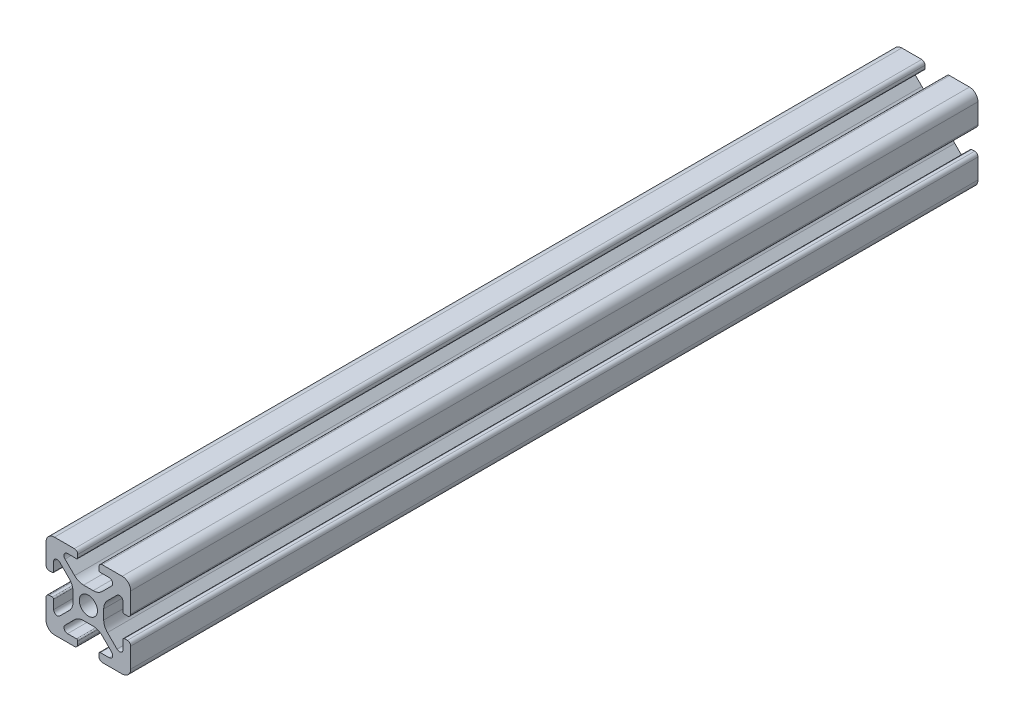
from build123d import *

# Parameters (mm, degrees)
SKETCH1_R                     = 2.1463
BOSS_EXTRUDE1_DEPTH           = 100
M6_CLEARANCE_HOLE1_AT_2_COUNT = 2
M6_CLEARANCE_HOLE1_AT_2_PITCH = 170


with BuildPart() as part:
    # Sketch1 → Boss-Extrude1 (new, symmetric)
    with BuildSketch(Plane.XY):
        with BuildLine():
            Line((-9.9949, 7.9883), (-9.9949, 3.2893))
            ThreePointArc((-9.9949, 3.2893), (-9.76427588, 2.73252412), (-9.2075, 2.5019))
            Line((-9.2075, 2.5019), (-8.4963, 2.5019))
            ThreePointArc((-8.4963, 2.5019), (-8.280773853, 2.591173853), (-8.1915, 2.8067))
            Line((-8.1915, 2.8067), (-8.1915, 4.9149))
            ThreePointArc((-8.1915, 4.9149), (-7.674065253, 5.689295824), (-6.760603096, 5.507596904))
            Line((-6.760603096, 5.507596904), (-4.505765747, 3.252759555))
            ThreePointArc((-4.505765747, 3.252759555), (-3.856054457, 2.280397894), (-3.627906192, 1.133419111))
            Line((-3.627906192, 1.133419111), (-3.627906192, -1.133419111))
            ThreePointArc((-3.627906192, -1.133419111), (-3.856054457, -2.280397894), (-4.505765747, -3.252759555))
            Line((-4.505765747, -3.252759555), (-6.760603096, -5.507596904))
            ThreePointArc((-6.760603096, -5.507596904), (-7.674065253, -5.689295824), (-8.1915, -4.9149))
            Line((-8.1915, -4.9149), (-8.1915, -2.8067))
            ThreePointArc((-8.1915, -2.8067), (-8.280773853, -2.591173853), (-8.4963, -2.5019))
            Line((-8.4963, -2.5019), (-9.2075, -2.5019))
            ThreePointArc((-9.2075, -2.5019), (-9.76427588, -2.73252412), (-9.9949, -3.2893))
            Line((-9.9949, -3.2893), (-9.9949, -7.9883))
            ThreePointArc((-9.9949, -7.9883), (-9.407180467, -9.407180467), (-7.9883, -9.9949))
            Line((-7.9883, -9.9949), (-3.2893, -9.9949))
            ThreePointArc((-3.2893, -9.9949), (-2.73252412, -9.76427588), (-2.5019, -9.2075))
            Line((-2.5019, -9.2075), (-2.5019, -8.4963))
            ThreePointArc((-2.5019, -8.4963), (-2.591173853, -8.280773853), (-2.8067, -8.1915))
            Line((-2.8067, -8.1915), (-4.9149, -8.1915))
            ThreePointArc((-4.9149, -8.1915), (-5.689295824, -7.674065253), (-5.507596904, -6.760603096))
            Line((-5.507596904, -6.760603096), (-3.252759555, -4.505765747))
            ThreePointArc((-3.252759555, -4.505765747), (-2.280397894, -3.856054457), (-1.133419111, -3.627906192))
            Line((-1.133419111, -3.627906192), (1.133419111, -3.627906192))
            ThreePointArc((1.133419111, -3.627906192), (2.280397894, -3.856054457), (3.252759555, -4.505765747))
            Line((3.252759555, -4.505765747), (5.507596904, -6.760603096))
            ThreePointArc((5.507596904, -6.760603096), (5.689295824, -7.674065253), (4.9149, -8.1915))
            Line((4.9149, -8.1915), (2.8067, -8.1915))
            ThreePointArc((2.8067, -8.1915), (2.591173853, -8.280773853), (2.5019, -8.4963))
            Line((2.5019, -8.4963), (2.5019, -9.2075))
            ThreePointArc((2.5019, -9.2075), (2.73252412, -9.76427588), (3.2893, -9.9949))
            Line((3.2893, -9.9949), (7.9883, -9.9949))
            ThreePointArc((7.9883, -9.9949), (9.407180467, -9.407180467), (9.9949, -7.9883))
            Line((9.9949, -7.9883), (9.9949, -3.2893))
            ThreePointArc((9.9949, -3.2893), (9.76427588, -2.73252412), (9.2075, -2.5019))
            Line((9.2075, -2.5019), (8.4963, -2.5019))
            ThreePointArc((8.4963, -2.5019), (8.280773853, -2.591173853), (8.1915, -2.8067))
            Line((8.1915, -2.8067), (8.1915, -4.9149))
            ThreePointArc((8.1915, -4.9149), (7.674065253, -5.689295824), (6.760603096, -5.507596904))
            Line((6.760603096, -5.507596904), (4.505765747, -3.252759555))
            ThreePointArc((4.505765747, -3.252759555), (3.856054457, -2.280397894), (3.627906192, -1.133419111))
            Line((3.627906192, -1.133419111), (3.627906192, 1.133419111))
            ThreePointArc((3.627906192, 1.133419111), (3.856054457, 2.280397894), (4.505765747, 3.252759555))
            Line((4.505765747, 3.252759555), (6.760603096, 5.507596904))
            ThreePointArc((6.760603096, 5.507596904), (7.674065253, 5.689295824), (8.1915, 4.9149))
            Line((8.1915, 4.9149), (8.1915, 2.8067))
            ThreePointArc((8.1915, 2.8067), (8.280773853, 2.591173853), (8.4963, 2.5019))
            Line((8.4963, 2.5019), (9.2075, 2.5019))
            ThreePointArc((9.2075, 2.5019), (9.76427588, 2.73252412), (9.9949, 3.2893))
            Line((9.9949, 3.2893), (9.9949, 7.9883))
            ThreePointArc((9.9949, 7.9883), (9.407180467, 9.407180467), (7.9883, 9.9949))
            Line((7.9883, 9.9949), (3.2893, 9.9949))
            ThreePointArc((3.2893, 9.9949), (2.73252412, 9.76427588), (2.5019, 9.2075))
            Line((2.5019, 9.2075), (2.5019, 8.4963))
            ThreePointArc((2.5019, 8.4963), (2.591173853, 8.280773853), (2.8067, 8.1915))
            Line((2.8067, 8.1915), (4.9149, 8.1915))
            ThreePointArc((4.9149, 8.1915), (5.689295824, 7.674065253), (5.507596904, 6.760603096))
            Line((5.507596904, 6.760603096), (3.252759555, 4.505765747))
            ThreePointArc((3.252759555, 4.505765747), (2.280397894, 3.856054457), (1.133419111, 3.627906192))
            Line((1.133419111, 3.627906192), (-1.133419111, 3.627906192))
            ThreePointArc((-1.133419111, 3.627906192), (-2.280397894, 3.856054457), (-3.252759555, 4.505765747))
            Line((-3.252759555, 4.505765747), (-5.507596904, 6.760603096))
            ThreePointArc((-5.507596904, 6.760603096), (-5.689295824, 7.674065253), (-4.9149, 8.1915))
            Line((-4.9149, 8.1915), (-2.8067, 8.1915))
            ThreePointArc((-2.8067, 8.1915), (-2.591173853, 8.280773853), (-2.5019, 8.4963))
            Line((-2.5019, 8.4963), (-2.5019, 9.2075))
            ThreePointArc((-2.5019, 9.2075), (-2.73252412, 9.76427588), (-3.2893, 9.9949))
            Line((-3.2893, 9.9949), (-7.9883, 9.9949))
            ThreePointArc((-7.9883, 9.9949), (-9.407180467, 9.407180467), (-9.9949, 7.9883))
        make_face()
        Circle(SKETCH1_R, mode=Mode.SUBTRACT)
    extrude(amount=BOSS_EXTRUDE1_DEPTH, both=True)

    # Sketch3 → M6 Clearance Hole1 (revolve, cut)
    with BuildSketch(Plane(origin=(0, 3.627906192, 87.637924257), x_dir=(0, 0, 1), z_dir=(1, 0, 0))):
        Polygon((0, 0), (0, 29.863012167), (3.5, 27.76), (3.5, 0), align=None)
    m6_clearance_hole1 = revolve(axis=Axis((0, 9.977906192, 87.637924257), (0, -1, 0)), mode=Mode.SUBTRACT)

    # M6 Clearance Hole1 at 2: M6 Clearance Hole1 ×2
    with Locations(*[(0, 0, -i * M6_CLEARANCE_HOLE1_AT_2_PITCH) for i in range(1, M6_CLEARANCE_HOLE1_AT_2_COUNT)]):
        add(m6_clearance_hole1, mode=Mode.SUBTRACT)


solid = part.part
